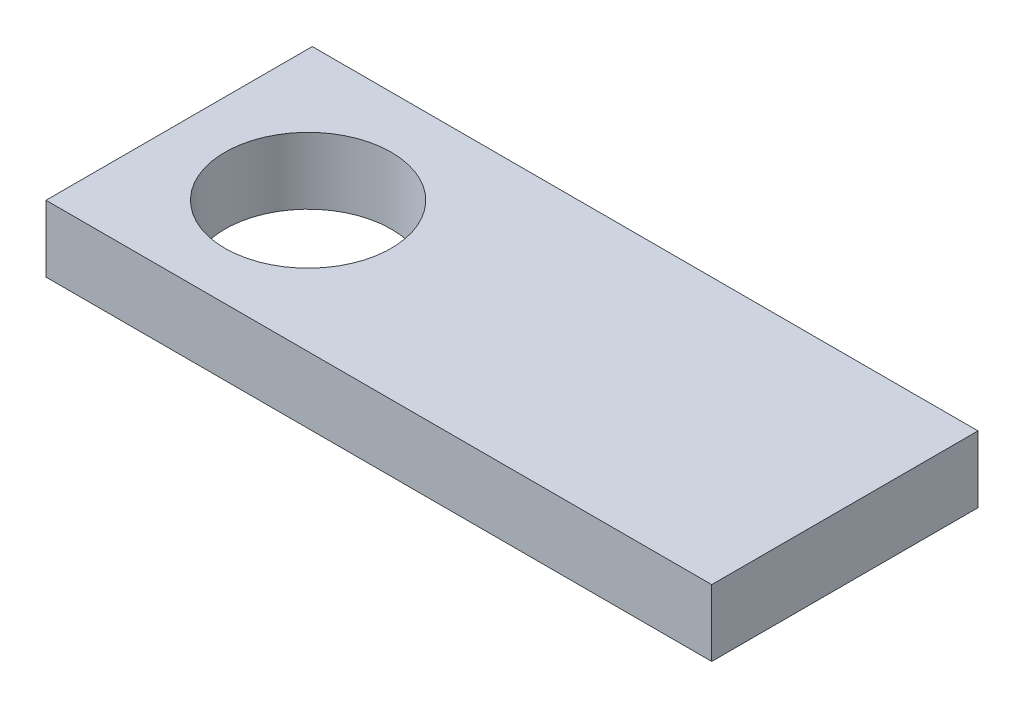
from build123d import *

# Parameters (mm, degrees)
SKETCH1_W           = 127
SKETCH1_H           = 50.8
BOSS_EXTRUDE1_DEPTH = 12.7
CUT_EXTRUDE1_DEPTH  = 12.7


with BuildPart() as part:
    # Sketch1 → Boss-Extrude1 (new body)
    with BuildSketch(Plane(origin=(0, 0, 0), x_dir=(1, 0, 0), z_dir=(0, 1, 0))):
        with Locations((63.5, 25.4)):
            Rectangle(SKETCH1_W, SKETCH1_H)
    extrude(amount=BOSS_EXTRUDE1_DEPTH)

    # Sketch2 → Cut-Extrude1 (cut)
    with BuildSketch(Plane(origin=(0, 12.7, 0), x_dir=(1, 0, 0), z_dir=(0, 1, 0))):
        with BuildLine():
            ThreePointArc((9.125, 25), (13.774679849, 13.774679849), (25, 9.125))
            Line((25, 9.125), (25, 25))
            Line((25, 25), (9.125, 25))
        make_face()
        with BuildLine():
            Line((25, 25), (25, 9.125))
            ThreePointArc((25, 9.125), (36.225320151, 13.774679849), (40.875, 25))
            ThreePointArc((40.875, 25), (25, 40.875), (9.125, 25))
            Line((9.125, 25), (25, 25))
        make_face()
    extrude(amount=-CUT_EXTRUDE1_DEPTH, mode=Mode.SUBTRACT)


solid = part.part
